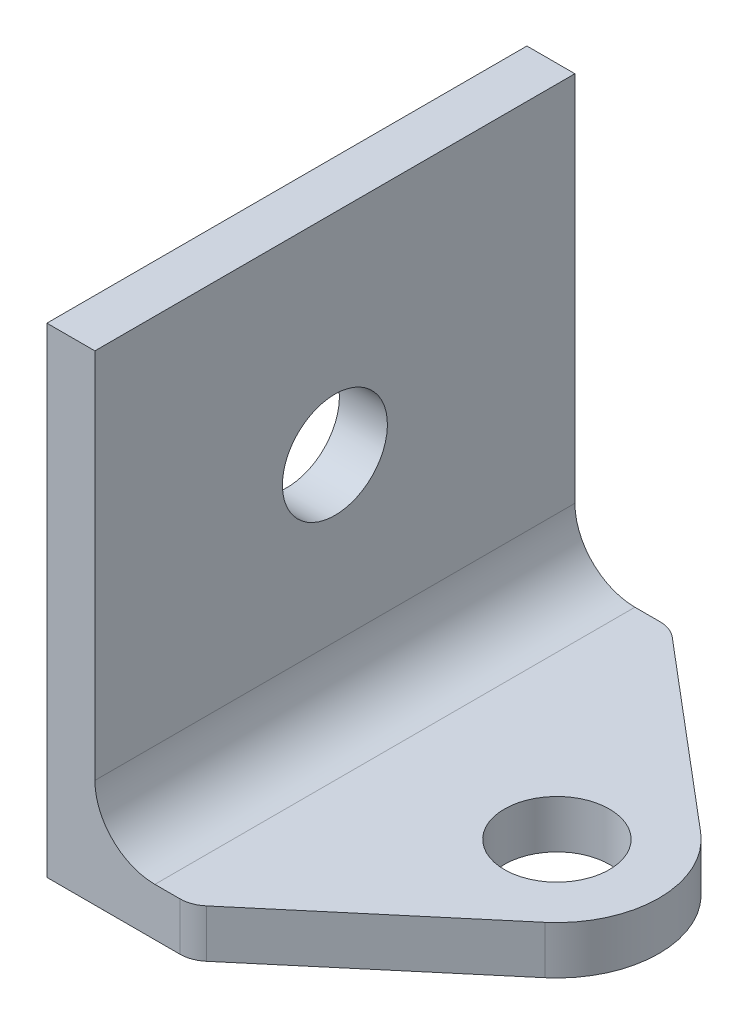
from build123d import *

# Parameters (mm, degrees)
AUFSATZ_AUFTRAGEN_MAIN_BODY_DEPTH = 40
SKIZZE3_R                         = 8.75
BOHRUNG_HORIZONTAL_DEPTH          = 115.821600755
SKIZZE4_R                         = 8.75
BOHRUNG_VERTIKAL_DEPTH            = 115.821600755
LINEAR_AUSTRAGEN_DEPTH            = 115.821600755
VERRUNDUNG_R                      = 5


with BuildPart() as part:
    # Skizze1 → Aufsatz Auftragen Main Body (new, symmetric)
    with BuildSketch(Plane.XY):
        with BuildLine():
            Line((0, 0), (80, 0))
            Line((80, 0), (80, 8))
            Line((80, 8), (18, 8))
            ThreePointArc((18, 8), (10.928932188, 10.928932188), (8, 18))
            Line((8, 18), (8, 80))
            Line((8, 80), (0, 80))
            Line((0, 80), (0, 0))
        make_face()
    extrude(amount=AUFSATZ_AUFTRAGEN_MAIN_BODY_DEPTH, both=True)

    # Skizze3 → Bohrung Horizontal (cut, through all)
    with BuildSketch(Plane(origin=(0, 8, 0), x_dir=(1, 0, 0), z_dir=(0, 1, 0))):
        with Locations(Location((45, 0, 0), (0, 0, 180))):
            Circle(SKIZZE3_R)
    extrude(amount=-BOHRUNG_HORIZONTAL_DEPTH, mode=Mode.SUBTRACT)

    # Skizze4 → Bohrung Vertikal (cut, through all)
    with BuildSketch(Plane(origin=(8, 0, 0), x_dir=(0, 0, -1), z_dir=(1, 0, 0))):
        with Locations(Location((0, 45, 0), (0, 0, 90))):
            Circle(SKIZZE4_R)
    extrude(amount=-BOHRUNG_VERTIKAL_DEPTH, mode=Mode.SUBTRACT)

    # Skizze5 → Linear Austragen (cut, through all)
    with BuildSketch(Plane(origin=(0, 8, 0), x_dir=(1, 0, 0), z_dir=(0, 1, 0))):
        with BuildLine():
            Line((24, -40), (55.971921298, -12.985258682))
            ThreePointArc((55.971921298, -12.985258682), (62, 0), (55.971921298, 12.985258682))
            Line((55.971921298, 12.985258682), (24, 40))
            Line((24, 40), (80, 40))
            Line((80, 40), (80, -40))
            Line((80, -40), (24, -40))
        make_face()
    extrude(amount=-LINEAR_AUSTRAGEN_DEPTH, mode=Mode.SUBTRACT)

    # Verrundung
    verrundung_edges = [part.edges().sort_by_distance(p)[0] for p in [
        (24, 4, 40),
        (24, 4, -40),
    ]]
    fillet(verrundung_edges, radius=VERRUNDUNG_R)


solid = part.part
